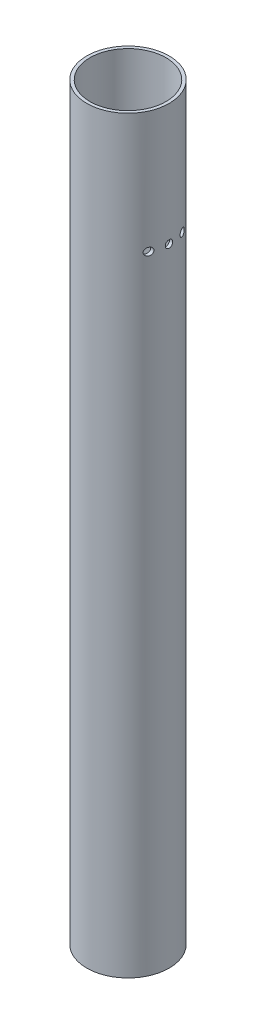
from build123d import *

# Parameters (mm, degrees)
SKETCH1_R               = 55
SKETCH1_R_2             = 48.6
BOSS_EXTRUDE1_DEPTH     = 500
CUT_EXTRUDE1_DEPTH      = 507.013833803
CUT_EXTRUDE1_DEPTH_BACK = 507.013833803
SKETCH3_R               = 5
CUT_EXTRUDE2_DEPTH      = 1004.020438586
CUT_EXTRUDE2_DEPTH_BACK = 1004.020438586
SKETCH4_R               = 50.8


with BuildPart() as part:
    # Sketch1 → Boss-Extrude1 (new, symmetric)
    with BuildSketch(Plane(origin=(0, 0, 0), x_dir=(1, 0, 0), z_dir=(0, 1, 0))):
        with Locations(Location((0, 0, 0), (0, 0, 270))):
            Circle(SKETCH1_R)
        with Locations(Location((0, 0, 0), (0, 0, 270))):
            Circle(SKETCH1_R_2, mode=Mode.SUBTRACT)
    extrude(amount=BOSS_EXTRUDE1_DEPTH, both=True)

    # Sketch3 → Cut-Extrude1 (cut, two sides: drawn at the far end of the back side and taken through both)
    with BuildSketch(Plane(origin=(0, 0, 0), x_dir=(0, 0, -1), z_dir=(1, 0, 0)).offset(-CUT_EXTRUDE1_DEPTH_BACK)):
        with Locations((0, 337.5)):
            Circle(SKETCH3_R)
        with Locations((22.5, 337.5)):
            Circle(SKETCH3_R)
        with Locations((-22.5, 337.5)):
            Circle(SKETCH3_R)
    extrude(amount=CUT_EXTRUDE1_DEPTH + CUT_EXTRUDE1_DEPTH_BACK, mode=Mode.SUBTRACT)

    # Sketch4 → Cut-Extrude2 (cut, two sides: drawn at the far end of the back side and taken through both)
    with BuildSketch(Plane(origin=(0, 500, 0), x_dir=(1, 0, 0), z_dir=(0, 1, 0)).offset(-CUT_EXTRUDE2_DEPTH_BACK)):
        with Locations(Location((0, 0, 0), (0, 0, 270))):
            Circle(SKETCH4_R)
    extrude(amount=CUT_EXTRUDE2_DEPTH + CUT_EXTRUDE2_DEPTH_BACK, mode=Mode.SUBTRACT)


solid = part.part
